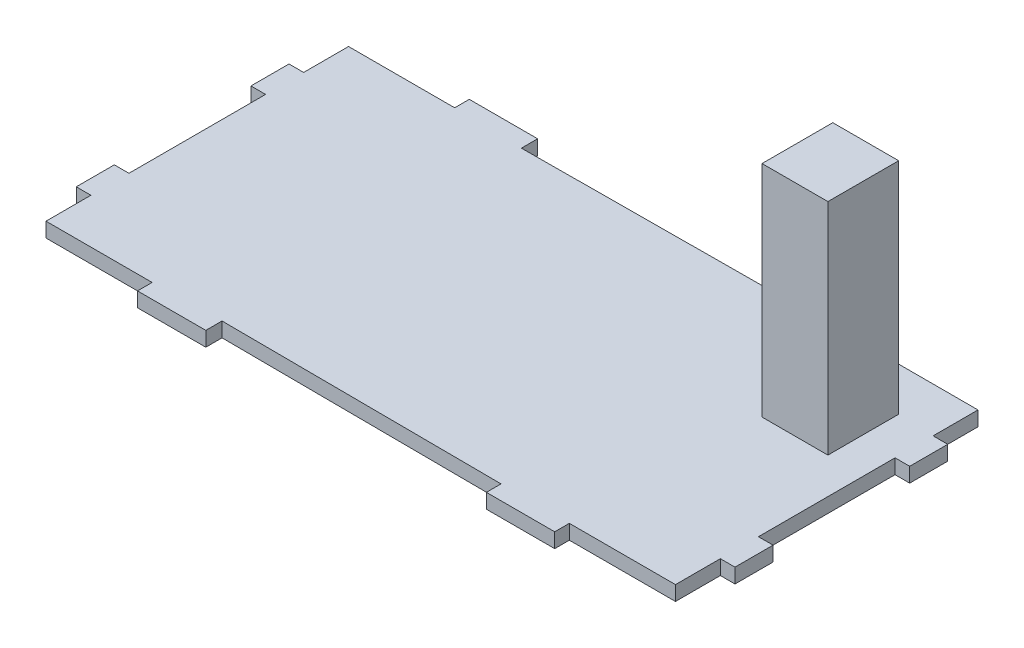
from build123d import *

# Parameters (mm, degrees)
SKETCH1_W           = 135
SKETCH1_H           = 68
BOSS_EXTRUDE1_DEPTH = 3
SKETCH2_W           = 3
SKETCH2_H           = 12.2
SKETCH2_H_2         = 28
CUT_EXTRUDE1_DEPTH  = 3
SKETCH3_W           = 21.75
SKETCH3_H           = 3
CUT_EXTRUDE2_DEPTH  = 3
SKETCH4_W           = 13.5
SKETCH4_H           = 14.5
BOSS_EXTRUDE2_DEPTH = 45


with BuildPart() as part:
    # Sketch1 → Boss-Extrude1 (new body)
    with BuildSketch(Plane(origin=(0, 0, 0), x_dir=(1, 0, 0), z_dir=(0, 1, 0))):
        Rectangle(SKETCH1_W, SKETCH1_H)
    extrude(amount=BOSS_EXTRUDE1_DEPTH)

    # Sketch2 → Cut-Extrude1 (cut)
    with BuildSketch(Plane(origin=(0, 3, 0), x_dir=(1, 0, 0), z_dir=(0, 1, 0))):
        with Locations((-66, 27.9)):
            Rectangle(SKETCH2_W, SKETCH2_H)
        with Locations((-66, 0)):
            Rectangle(SKETCH2_W, SKETCH2_H_2)
        with Locations((-66, -27.9)):
            Rectangle(SKETCH2_W, SKETCH2_H)
    cut_extrude1 = extrude(amount=-CUT_EXTRUDE1_DEPTH, mode=Mode.SUBTRACT)

    # Mirror1: Cut-Extrude1 across plane
    add(cut_extrude1.mirror(Plane(origin=(0, 0, 0), x_dir=(0, 0, 1), z_dir=(1, 0, 0))), mode=Mode.SUBTRACT)

    # Sketch3 → Cut-Extrude2 (cut)
    with BuildSketch(Plane(origin=(0, 3, 0), x_dir=(1, 0, 0), z_dir=(0, 1, 0))):
        with Locations((-53.625, 32.5)):
            Rectangle(SKETCH3_W, SKETCH3_H)
        Polygon((28.75, 34), (-28.75, 34), (-28.75, 30.671368382), (28.75, 31), align=None)
        with Locations((53.625, 32.5)):
            Rectangle(SKETCH3_W, SKETCH3_H)
    cut_extrude2 = extrude(amount=-CUT_EXTRUDE2_DEPTH, mode=Mode.SUBTRACT)

    # Mirror2: Cut-Extrude2 across plane
    add(cut_extrude2.mirror(Plane.XY), mode=Mode.SUBTRACT)

    # Sketch4 → Boss-Extrude2 (add)
    with BuildSketch(Plane(origin=(0, 3, 0), x_dir=(1, 0, 0), z_dir=(0, 1, 0))):
        with Locations((50.39, 14.85)):
            Rectangle(SKETCH4_W, SKETCH4_H)
    extrude(amount=BOSS_EXTRUDE2_DEPTH)


solid = part.part
